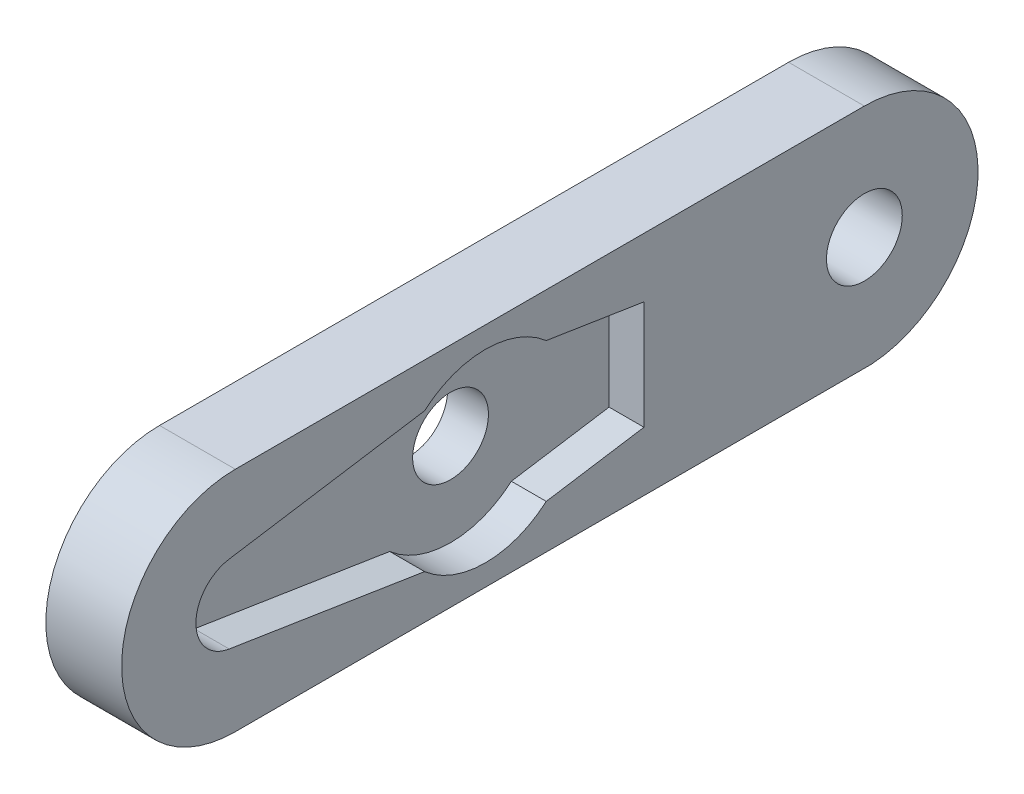
from build123d import *
from build123d.topology import SkipClean

# Parameters (mm, degrees)
SKETCH1_R           = 2.5
BOSS_EXTRUDE1_DEPTH = 2.3
BOSS_EXTRUDE2_START = 2.7
SKETCH2_R           = 2.5
BOSS_EXTRUDE2_DEPTH = 2.7
SKETCH3_R           = 2.5
CUT_EXTRUDE1_DEPTH  = 10
BOSS_EXTRUDE3_START = -5
SKETCH4_R           = 2.5
BOSS_EXTRUDE3_DEPTH = 5
CUT_EXTRUDE2_DEPTH  = 5


with BuildPart() as part:
    # Sketch1 → Boss-Extrude1 (new body)
    with BuildSketch(Plane(origin=(0, 0, 0), x_dir=(0, 0, -1), z_dir=(1, 0, 0))):
        with BuildLine():
            Line((-16.5, -7.5), (20.481500629, -7.48452785))
            ThreePointArc((20.481500629, -7.48452785), (27.496130965, 0.240874575), (20, 7.5))
            Line((20, 7.5), (-16.5, 7.5))
            ThreePointArc((-16.5, 7.5), (-24, 0), (-16.5, -7.5))
        make_face()
        with BuildLine():
            Line((4.012796555, 4.594285996), (10.45821766, 3.581381658))
            Line((10.45821766, 3.581381658), (10.45821766, 0))
            Line((10.45821766, 0), (10.45821766, -3.581381658))
            Line((10.45821766, -3.581381658), (4.012796555, -4.594285996))
            ThreePointArc((4.012796555, -4.594285996), (0, -6.1), (-4.012796555, -4.594285996))
            Line((-4.012796555, -4.594285996), (-9.954017871, -3.660617157))
            Line((-9.954017871, -3.660617157), (-16.903638766, -2.568477321))
            ThreePointArc((-16.903638766, -2.568477321), (-19.1, 0), (-16.903638766, 2.568477321))
            Line((-16.903638766, 2.568477321), (-4.012796555, 4.594285996))
            ThreePointArc((-4.012796555, 4.594285996), (0, 6.1), (4.012796555, 4.594285996))
        make_face(mode=Mode.SUBTRACT)
        with Locations((20, 0)):
            Circle(SKETCH1_R, mode=Mode.SUBTRACT)
    extrude(amount=BOSS_EXTRUDE1_DEPTH)

    # Sketch2 → Boss-Extrude2 (add)
    with SkipClean():  # the faces are left unmerged after this step: merging them gives an invalid solid
        with BuildSketch(Plane.ZY.offset(BOSS_EXTRUDE2_START)):
            with BuildLine():
                Line((16.5, 7.5), (-20, 7.5))
                ThreePointArc((-20, 7.5), (-27.496130965, 0.240874575), (-20.481500629, -7.48452785))
                Line((-20.481500629, -7.48452785), (16.5, -7.5))
                ThreePointArc((16.5, -7.5), (24, 0), (16.5, 7.5))
            make_face()
            with Locations((-20, 0)):
                Circle(SKETCH2_R, mode=Mode.SUBTRACT)
        extrude(amount=-BOSS_EXTRUDE2_DEPTH)

    # Sketch3 → Cut-Extrude1 (cut)
    with SkipClean():  # the faces are left unmerged after this step: merging them gives an invalid solid
        with BuildSketch(Plane(origin=(0, 0, 0), x_dir=(0, 0, -1), z_dir=(1, 0, 0))):
            Circle(SKETCH3_R)
        extrude(amount=-CUT_EXTRUDE1_DEPTH, mode=Mode.SUBTRACT)

    # Sketch4 → Boss-Extrude3 (add)
    with BuildSketch(Plane(origin=(2.3, 0, 0), x_dir=(0, 0, -1), z_dir=(1, 0, 0)).offset(BOSS_EXTRUDE3_START)):
        with BuildLine():
            ThreePointArc((25.481500629, -7.48452785), (32.496130965, 0.240874575), (25, 7.5))
            Line((25, 7.5), (20, 7.5))
            ThreePointArc((20, 7.5), (27.496130965, 0.240874575), (20.481500629, -7.48452785))
            Line((20.481500629, -7.48452785), (25.481500629, -7.48452785))
        make_face()
        with Locations((20, 0)):
            Circle(SKETCH4_R)
    extrude(amount=BOSS_EXTRUDE3_DEPTH)

    # Sketch4<3> → Cut-Extrude2 (cut)
    with BuildSketch(Plane(origin=(2.3, 0, 0), x_dir=(0, 0, -1), z_dir=(1, 0, 0))):
        with BuildLine():
            ThreePointArc((22.5, 0), (25, -2.5), (27.5, 0))
            ThreePointArc((27.5, 0), (25, 2.5), (22.5, 0))
        make_face()
    extrude(amount=-CUT_EXTRUDE2_DEPTH, mode=Mode.SUBTRACT)


solid = part.part
